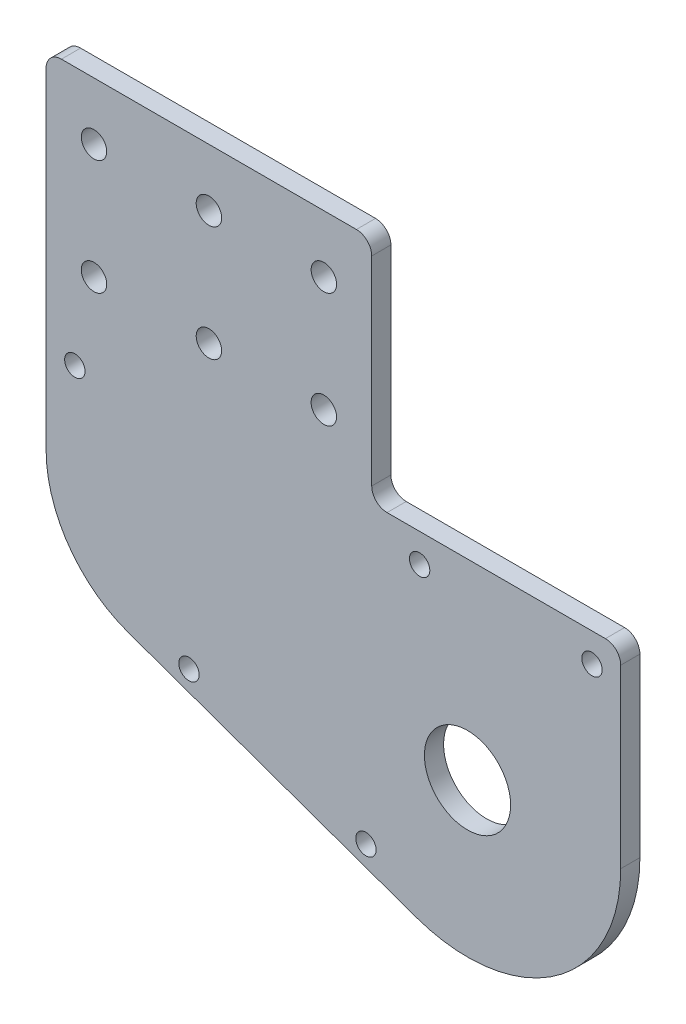
from build123d import *

# Parameters (mm, degrees)
BOSS_EXTRUDE1_DEPTH     = 6.35
SKETCH3_W               = 107.95
SKETCH3_H               = 76.2
BOSS_EXTRUDE2_DEPTH     = 6.35
FILLET1_R               = 5.08
CUT_EXTRUDE1_REACH      = 199.668
SKETCH4_R               = 14.2875
F_1_4_CLEARANCE_HOLE1_D = 6.7564
SKETCH12_R              = 4.2164
CUT_EXTRUDE2_DEPTH      = 6.35


with BuildPart() as part:
    # Sketch2 → Boss-Extrude1 (new body)
    with BuildSketch(Plane.XY):
        with BuildLine():
            Line((50.8, 63.5), (-139.7, 63.5))
            Line((-139.7, 63.5), (-139.7, 24.9428))
            ThreePointArc((-139.7, 24.9428), (-132.170466199, 1.196645543), (-112.333373337, -13.871980059))
            Line((-112.333373337, -13.871980059), (-17.064303956, -47.848192552))
            ThreePointArc((-17.064303956, -47.848192552), (29.272626795, -41.518108344), (50.8, 0))
            Line((50.8, 0), (50.8, 63.5))
        make_face()
    extrude(amount=-BOSS_EXTRUDE1_DEPTH)

    # Sketch3 → Boss-Extrude2 (add)
    with BuildSketch(Plane.XY):
        with Locations((-85.725, 101.6)):
            Rectangle(SKETCH3_W, SKETCH3_H)
    extrude(amount=-BOSS_EXTRUDE2_DEPTH)

    # Fillet1
    fillet1_edges = [part.edges().sort_by_distance(p)[0] for p in [
        (50.8, 63.5, -3.175),
        (-31.75, 139.7, -3.175),
        (-139.7, 139.7, -3.175),
        (-31.75, 63.5, -3.175),
    ]]
    fillet(fillet1_edges, radius=FILLET1_R)

    # Sketch4 → Cut-Extrude1 (cut, up to next)
    with BuildSketch(Plane.XY, mode=Mode.PRIVATE) as cut_extrude1_sk1:
        Circle(SKETCH4_R)
    cut_extrude1_tool1 = extrude(cut_extrude1_sk1.sketch, amount=-CUT_EXTRUDE1_REACH, mode=Mode.PRIVATE) & part.part
    add(cut_extrude1_tool1.solids().sort_by_distance((0, 0, 0))[0], mode=Mode.SUBTRACT)

    # 1/4 Clearance Hole1 (through all)
    with Locations(Plane.XY):
        with Locations((-33.671992271, -35.183583732), (-92.344956452, -14.258795534), (-130.175, 53.975), (-15.875, 53.975), (41.275, 53.975)):
            Hole(F_1_4_CLEARANCE_HOLE1_D / 2)

    # Sketch12 → Cut-Extrude2 (cut)
    with BuildSketch(Plane.XY):
        with Locations((-123.825, 120.65)):
            Circle(SKETCH12_R)
        with Locations((-123.825, 82.55)):
            Circle(SKETCH12_R)
        with Locations((-85.725, 120.65)):
            Circle(SKETCH12_R)
        with Locations((-85.725, 82.55)):
            Circle(SKETCH12_R)
        with Locations((-47.625, 82.55)):
            Circle(SKETCH12_R)
        with Locations((-47.625, 120.65)):
            Circle(SKETCH12_R)
    extrude(amount=-CUT_EXTRUDE2_DEPTH, mode=Mode.SUBTRACT)


solid = part.part
